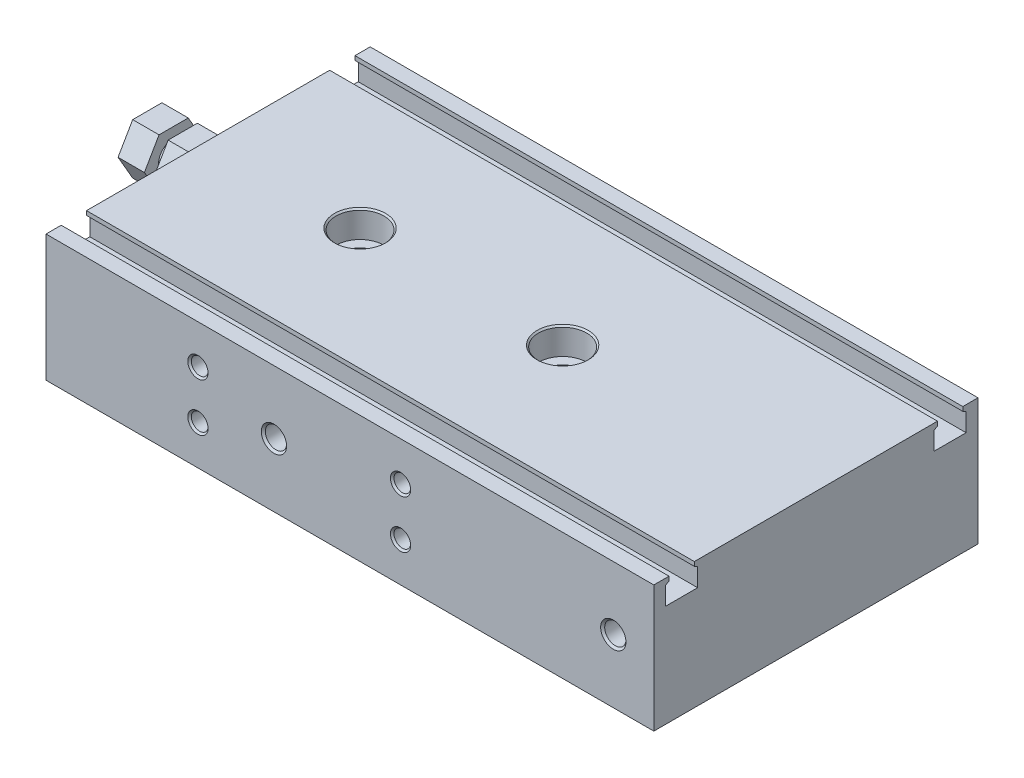
from build123d import *

# Parameters (mm, degrees)
BODY_SKETCH_W                                = 64
BODY_SKETCH_H                                = 25
BODY_DEPTH                                   = 120
BODY_ROD_HOLES_SKETCH_R                      = 5
BODY_ROD_HOLES_DEPTH                         = 10
BODY_PISTON_HOLES_SKETCH_R                   = 6.05
BODY_PISTON_HOLES_DEPTH                      = 51
TOP_SWITCH_GROOVES_DEPTH                     = 125.820871652
SHCS_MGT_HOLE_CHAM_SIZE                      = 0.3
SHCS_MGT_HOLE_PAT_COUNT                      = 2
SHCS_MGT_HOLE_PAT_PITCH                      = 40
SHCS_MGT_HOLE_CHAM_OF_SHCS_MGT_HOLE_PAT_SIZE = 0.3
SHCS_MGT_HOLE_BOT_TAP_AT_2_COUNT             = 2
SHCS_MGT_HOLE_BOT_TAP_AT_2_PITCH             = 40
ADJUSTER_NUT_DEPTH                           = 12
ADJUSTER_NUT_THREADS_SKETCH_W                = 1.8
ADJUSTER_NUT_THREADS_SKETCH_H                = 25
TAP_DRILL_FOR_M5X0_8_TAP1_D                  = 4.2
TAP_DRILL_FOR_M5X0_8_TAP1_DEPTH              = 4.5
TAP_DRILL_FOR_M5X0_8_TAP1_CSINK_D            = 5
TAP_DRILL_FOR_M5X0_8_TAP1_CSINK_ANGLE        = 90
TAP_DRILL_FOR_M5X0_8_TAP1_TIP                = 1.2618073
TAP_DRILL_FOR_M5X0_8_TAP2_D                  = 4.2
TAP_DRILL_FOR_M5X0_8_TAP2_DEPTH              = 4.5
TAP_DRILL_FOR_M5X0_8_TAP2_CSINK_D            = 5
TAP_DRILL_FOR_M5X0_8_TAP2_CSINK_ANGLE        = 90
TAP_DRILL_FOR_M5X0_8_TAP2_TIP                = 1.2618073
MOUNT_HOLES_1_D                              = 3.3
MOUNT_HOLES_1_DEPTH                          = 5.5
MOUNT_HOLES_1_CSINK_D                        = 4
MOUNT_HOLES_1_CSINK_ANGLE                    = 90
MOUNT_HOLES_1_TIP                            = 0.991420021
MOUNT_HOLES_2_D                              = 3.3
MOUNT_HOLES_2_DEPTH                          = 5.5
MOUNT_HOLES_2_CSINK_D                        = 4
MOUNT_HOLES_2_CSINK_ANGLE                    = 90
MOUNT_HOLES_2_TIP                            = 0.991420021
MOUNT_HOLES_3_D                              = 3.3
MOUNT_HOLES_3_DEPTH                          = 5.5
MOUNT_HOLES_3_CSINK_D                        = 4
MOUNT_HOLES_3_CSINK_ANGLE                    = 90
MOUNT_HOLES_3_TIP                            = 0.991420021
MOUNT_HOLES_4_D                              = 3.3
MOUNT_HOLES_4_DEPTH                          = 5.5
MOUNT_HOLES_4_CSINK_D                        = 4
MOUNT_HOLES_4_CSINK_ANGLE                    = 90
MOUNT_HOLES_4_TIP                            = 0.991420021


with BuildPart() as part:
    # Body_Sketch → Body (new body)
    with BuildSketch(Plane(origin=(0, 0, 0), x_dir=(0, 0, -1), z_dir=(1, 0, 0))):
        Rectangle(BODY_SKETCH_W, BODY_SKETCH_H)
    extrude(amount=BODY_DEPTH)

    # Body Rod Holes_Sketch → Body Rod Holes (cut)
    with BuildSketch(Plane.ZY):
        with Locations((-14, 0)):
            Circle(BODY_ROD_HOLES_SKETCH_R)
        with Locations(Location((14, 0, 0), (0, 0, 180))):
            Circle(BODY_ROD_HOLES_SKETCH_R)
    extrude(amount=-BODY_ROD_HOLES_DEPTH, mode=Mode.SUBTRACT)

    # Body Piston Holes_Sketch → Body Piston Holes (cut)
    with BuildSketch(Plane.ZY.offset(-10)):
        with Locations((14, 0)):
            Circle(BODY_PISTON_HOLES_SKETCH_R)
        with Locations((-14, 0)):
            Circle(BODY_PISTON_HOLES_SKETCH_R)
    extrude(amount=-BODY_PISTON_HOLES_DEPTH, mode=Mode.SUBTRACT)

    # Top Switch Grooves_Sketch → Top Switch Grooves (cut, through all)
    with BuildSketch(Plane.ZY):
        Polygon((23.35, 7.7), (29.65, 7.7), (29.65, 11.3), (29, 11.675277675), (29, 12.5), (24, 12.5), (24, 11.675277675), (23.35, 11.3), align=None)
        Polygon((-23.35, 11.3), (-23.35, 7.7), (-29.65, 7.7), (-29.65, 11.3), (-29, 11.675277675), (-29, 12.5), (-24, 12.5), (-24, 11.675277675), align=None)
    extrude(amount=-TOP_SWITCH_GROOVES_DEPTH, mode=Mode.SUBTRACT)

    # SHCS MGT Hole_Sketch → SHCS MGT Hole (revolve, cut)
    with BuildSketch(Plane.XY, mode=Mode.PRIVATE) as shcs_mgt_hole_sk:
        Polygon((30, 12.5), (25.25, 12.5), (25.25, 7.2), (27.25, 7.2), (27.25, -12.5), (30, -12.5), align=None)
    shcs_mgt_hole = revolve(shcs_mgt_hole_sk.sketch.rotate(Axis((30, -11.506886035, 0), (0, 1, 0)), 270), axis=Axis((30, -11.506886035, 0), (0, 1, 0)), mode=Mode.SUBTRACT)

    # SHCS MGT Hole Cham
    shcs_mgt_hole_cham_edges = [part.edges().sort_by_distance(p)[0] for p in [
        (30, 12.5, 4.75),
    ]]
    chamfer(shcs_mgt_hole_cham_edges, length=SHCS_MGT_HOLE_CHAM_SIZE)

    # SHCS MGT Hole Pat: SHCS MGT Hole ×2
    with Locations(*[(i * SHCS_MGT_HOLE_PAT_PITCH, 0, 0) for i in range(1, SHCS_MGT_HOLE_PAT_COUNT)]):
        add(shcs_mgt_hole, mode=Mode.SUBTRACT)

    # SHCS MGT Hole Cham of SHCS MGT Hole Pat
    shcs_mgt_hole_cham_of_shcs_mgt_hole_pat_edges = [part.edges().sort_by_distance(p)[0] for p in [
        (70, 12.5, 4.75),
    ]]
    chamfer(shcs_mgt_hole_cham_of_shcs_mgt_hole_pat_edges, length=SHCS_MGT_HOLE_CHAM_OF_SHCS_MGT_HOLE_PAT_SIZE)

    # SHCS MGT Hole Bot Tap Profile → SHCS MGT Hole Bot Tap (revolve, cut)
    with BuildSketch(Plane(origin=(30, -12.5, 0), x_dir=(0, 0, -1), z_dir=(1, 0, 0))):
        Polygon((0, 0), (0, 12.652366702), (2.75, 11), (2.75, 10), (3, 10), (3, 0.3), (3.3, 0), align=None)
    shcs_mgt_hole_bot_tap = revolve(axis=Axis((30, -18.85, 0), (0, 1, 0)), mode=Mode.SUBTRACT)

    # SHCS MGT Hole Bot Tap at 2: SHCS MGT Hole Bot Tap ×2
    with Locations(*[(i * SHCS_MGT_HOLE_BOT_TAP_AT_2_PITCH, 0, 0) for i in range(1, SHCS_MGT_HOLE_BOT_TAP_AT_2_COUNT)]):
        add(shcs_mgt_hole_bot_tap, mode=Mode.SUBTRACT)

    # Adjuster Nut_Sketch → Adjuster Nut (add)
    with BuildSketch(Plane.ZY):
        Polygon((-2.886751346, 11.5), (2.886751346, 11.5), (5.773502692, 6.5), (2.886751346, 1.5), (-2.886751346, 1.5), (-5.773502692, 6.5), align=None)
    extrude(amount=ADJUSTER_NUT_DEPTH)

    # Adjuster Nut Threads_Sketch → Adjuster Nut Threads (revolve, cut)
    with BuildSketch(Plane.XY, mode=Mode.PRIVATE) as adjuster_nut_threads_sk:
        with Locations((-5.9, 22)):
            Rectangle(ADJUSTER_NUT_THREADS_SKETCH_W, ADJUSTER_NUT_THREADS_SKETCH_H)
    revolve(adjuster_nut_threads_sk.sketch.rotate(Axis((-6.476, 6.5, 0), (1, 0, 0)), 270), axis=Axis((-6.476, 6.5, 0), (1, 0, 0)), mode=Mode.SUBTRACT)

    # Tap Drill for M5x0.8 Tap1
    with Locations(Plane.XY.offset(32)):
        with Locations((45, 0), (112, 0)):
            CounterSinkHole(TAP_DRILL_FOR_M5X0_8_TAP1_D / 2, TAP_DRILL_FOR_M5X0_8_TAP1_CSINK_D / 2, depth=TAP_DRILL_FOR_M5X0_8_TAP1_DEPTH, counter_sink_angle=TAP_DRILL_FOR_M5X0_8_TAP1_CSINK_ANGLE)
            with Locations((0, 0, -(TAP_DRILL_FOR_M5X0_8_TAP1_DEPTH + TAP_DRILL_FOR_M5X0_8_TAP1_TIP / 2))):  # 118° drill point
                Cone(0, TAP_DRILL_FOR_M5X0_8_TAP1_D / 2, TAP_DRILL_FOR_M5X0_8_TAP1_TIP, mode=Mode.SUBTRACT)

    # Tap Drill for M5x0.8 Tap2
    with Locations(Plane(origin=(0, 0, -32), x_dir=(-1, 0, 0), z_dir=(0, 0, -1))):
        with Locations((-112, 0), (-45, 0)):
            CounterSinkHole(TAP_DRILL_FOR_M5X0_8_TAP2_D / 2, TAP_DRILL_FOR_M5X0_8_TAP2_CSINK_D / 2, depth=TAP_DRILL_FOR_M5X0_8_TAP2_DEPTH, counter_sink_angle=TAP_DRILL_FOR_M5X0_8_TAP2_CSINK_ANGLE)
            with Locations((0, 0, -(TAP_DRILL_FOR_M5X0_8_TAP2_DEPTH + TAP_DRILL_FOR_M5X0_8_TAP2_TIP / 2))):  # 118° drill point
                Cone(0, TAP_DRILL_FOR_M5X0_8_TAP2_D / 2, TAP_DRILL_FOR_M5X0_8_TAP2_TIP, mode=Mode.SUBTRACT)

    # Mount_Holes_1
    with Locations(Plane.XY.offset(32)):
        with Locations((30, -4.75), (70, -4.75)):
            CounterSinkHole(MOUNT_HOLES_1_D / 2, MOUNT_HOLES_1_CSINK_D / 2, depth=MOUNT_HOLES_1_DEPTH, counter_sink_angle=MOUNT_HOLES_1_CSINK_ANGLE)
            with Locations((0, 0, -(MOUNT_HOLES_1_DEPTH + MOUNT_HOLES_1_TIP / 2))):  # 118° drill point
                Cone(0, MOUNT_HOLES_1_D / 2, MOUNT_HOLES_1_TIP, mode=Mode.SUBTRACT)

    # Mount_Holes_2
    with Locations(Plane(origin=(0, 0, -32), x_dir=(-1, 0, 0), z_dir=(0, 0, -1))):
        with Locations((-70, -4.75), (-30, -4.75)):
            CounterSinkHole(MOUNT_HOLES_2_D / 2, MOUNT_HOLES_2_CSINK_D / 2, depth=MOUNT_HOLES_2_DEPTH, counter_sink_angle=MOUNT_HOLES_2_CSINK_ANGLE)
            with Locations((0, 0, -(MOUNT_HOLES_2_DEPTH + MOUNT_HOLES_2_TIP / 2))):  # 118° drill point
                Cone(0, MOUNT_HOLES_2_D / 2, MOUNT_HOLES_2_TIP, mode=Mode.SUBTRACT)

    # Mount_Holes_3
    with Locations(Plane.XY.offset(32)):
        with Locations((30, 4.75), (70, 4.75)):
            CounterSinkHole(MOUNT_HOLES_3_D / 2, MOUNT_HOLES_3_CSINK_D / 2, depth=MOUNT_HOLES_3_DEPTH, counter_sink_angle=MOUNT_HOLES_3_CSINK_ANGLE)
            with Locations((0, 0, -(MOUNT_HOLES_3_DEPTH + MOUNT_HOLES_3_TIP / 2))):  # 118° drill point
                Cone(0, MOUNT_HOLES_3_D / 2, MOUNT_HOLES_3_TIP, mode=Mode.SUBTRACT)

    # Mount_Holes_4
    with Locations(Plane(origin=(0, 0, -32), x_dir=(-1, 0, 0), z_dir=(0, 0, -1))):
        with Locations((-70, 4.75), (-30, 4.75)):
            CounterSinkHole(MOUNT_HOLES_4_D / 2, MOUNT_HOLES_4_CSINK_D / 2, depth=MOUNT_HOLES_4_DEPTH, counter_sink_angle=MOUNT_HOLES_4_CSINK_ANGLE)
            with Locations((0, 0, -(MOUNT_HOLES_4_DEPTH + MOUNT_HOLES_4_TIP / 2))):  # 118° drill point
                Cone(0, MOUNT_HOLES_4_D / 2, MOUNT_HOLES_4_TIP, mode=Mode.SUBTRACT)


solid = part.part
